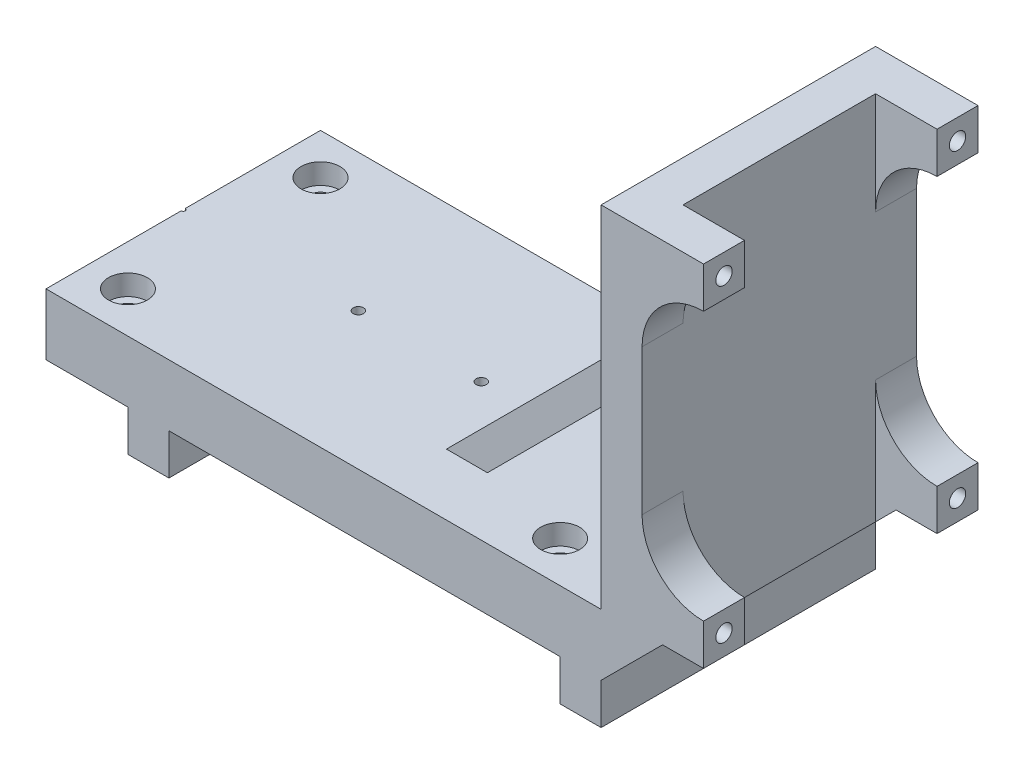
from build123d import *

# Parameters (mm, degrees)
EXTRUDE_2_DEPTH              = 67
CUT_EXTRUDE_5_DEPTH          = 15
CUT_EXTRUDE_6_DEPTH          = 15
SKETCH_4_W                   = 15
SKETCH_4_H                   = 47
CUT_EXTRUDE_7_DEPTH          = 100
CUT_EXTRUDE_8_DEPTH          = 100
CUT_EXTRUDE_11_DEPTH         = 25
CUT_EXTRUDE_12_DEPTH         = 25
CUT_EXTRUDE_13_DEPTH         = 25
CUT_EXTRUDE_14_DEPTH         = 25
HOLE_WIZARD_M5_1_D           = 5.5
HOLE_WIZARD_M5_1_CBORE_D     = 9.5
HOLE_WIZARD_M5_1_CBORE_DEPTH = 5
SKETCH_24_R                  = 1.25
CUT_EXTRUDE_15_DEPTH         = 50
SKETCH_25_W                  = 20
SKETCH_25_H                  = 10
CUT_EXTRUDE_16_DEPTH         = 100


with BuildPart() as part:
    # 스케치1 → 보스-돌출2 (new body)
    with BuildSketch(Plane.XY):
        with BuildLine():
            Line((0, 85.5), (0, 52.75))
            Line((0, 52.75), (-52.75, 0))
            Line((-52.75, 0), (-135.5, 0))
            Line((-135.5, 0), (-135.5, -15))
            Line((-135.5, -15), (-115.5, -15))
            Line((-115.5, -15), (-115.5, -25))
            Line((-115.5, -25), (-85.5, -25))
            Line((-85.5, -25), (-85.5, -15))
            Line((-85.5, -15), (-10, -15))
            Line((-10, -15), (-10, -25))
            Line((-10, -25), (0, -25))
            Line((0, -25), (0, -15))
            Line((0, -15), (15, 0))
            Line((15, 0), (25, 0))
            Line((25, 0), (25, 10))
            ThreePointArc((25, 10), (14.393398282, 14.393398282), (10, 25))
            Line((10, 25), (10, 60.5))
            ThreePointArc((10, 60.5), (14.393398282, 71.106601718), (25, 75.5))
            Line((25, 75.5), (25, 85.5))
            Line((25, 85.5), (0, 85.5))
        make_face()
        Polygon((-42.75, 0), (0, 42.75), (0, 0), align=None, mode=Mode.SUBTRACT)
    extrude(amount=EXTRUDE_2_DEPTH)

    # 스케치2 → 컷-돌출5 (cut)
    with BuildSketch(Plane.XY.offset(67)):
        Polygon((0, 52.75), (0, 42.75), (-42.75, 0), (-52.75, 0), align=None)
    extrude(amount=-CUT_EXTRUDE_5_DEPTH, mode=Mode.SUBTRACT)

    # 스케치3 → 컷-돌출6 (cut)
    with BuildSketch(Plane(origin=(0, 0, 0), x_dir=(-1, 0, 0), z_dir=(0, 0, -1))):
        Polygon((0, 52.75), (0, 42.75), (42.75, 0), (52.75, 0), align=None)
    extrude(amount=-CUT_EXTRUDE_6_DEPTH, mode=Mode.SUBTRACT)

    # 스케치4 → 컷-돌출7 (cut)
    with BuildSketch(Plane(origin=(0, 85.5, 0), x_dir=(1, 0, 0), z_dir=(0, 1, 0))):
        with Locations((17.5, -33.5)):
            Rectangle(SKETCH_4_W, SKETCH_4_H)
    extrude(amount=-CUT_EXTRUDE_7_DEPTH, mode=Mode.SUBTRACT)

    # 스케치5 → 컷-돌출8 (cut)
    with BuildSketch(Plane(origin=(0, 0, 0), x_dir=(1, 0, 0), z_dir=(0, 1, 0))):
        with BuildLine():
            ThreePointArc((-135.5, -34), (-135, -33.5), (-135.5, -33))
            Line((-135.5, -33), (-135.5, -33.5))
            Line((-135.5, -33.5), (-135.5, -34))
        make_face()
    extrude(amount=-CUT_EXTRUDE_8_DEPTH, mode=Mode.SUBTRACT)

    # 스케치8 → 컷-돌출11 (cut)
    with BuildSketch(Plane(origin=(25, 0, 0), x_dir=(0, 0, -1), z_dir=(1, 0, 0))):
        with BuildLine():
            ThreePointArc((-60, 80.5), (-62, 82.5), (-64, 80.5))
            Line((-64, 80.5), (-60, 80.5))
        make_face()
        with BuildLine():
            Line((-60, 80.5), (-64, 80.5))
            ThreePointArc((-64, 80.5), (-62, 78.5), (-60, 80.5))
        make_face()
    extrude(amount=-CUT_EXTRUDE_11_DEPTH, mode=Mode.SUBTRACT)

    # 스케치10 → 컷-돌출12 (cut)
    with BuildSketch(Plane(origin=(25, 0, 0), x_dir=(0, 0, -1), z_dir=(1, 0, 0))):
        with BuildLine():
            ThreePointArc((-3, 80.5), (-5, 82.5), (-7, 80.5))
            Line((-7, 80.5), (-3, 80.5))
        make_face()
        with BuildLine():
            Line((-3, 80.5), (-7, 80.5))
            ThreePointArc((-7, 80.5), (-5, 78.5), (-3, 80.5))
        make_face()
    extrude(amount=-CUT_EXTRUDE_12_DEPTH, mode=Mode.SUBTRACT)

    # 스케치11 → 컷-돌출13 (cut)
    with BuildSketch(Plane(origin=(25, 0, 0), x_dir=(0, 0, -1), z_dir=(1, 0, 0))):
        with BuildLine():
            ThreePointArc((-64, 5), (-62, 3), (-60, 5))
            Line((-60, 5), (-64, 5))
        make_face()
        with BuildLine():
            Line((-64, 5), (-60, 5))
            ThreePointArc((-60, 5), (-62, 7), (-64, 5))
        make_face()
    extrude(amount=-CUT_EXTRUDE_13_DEPTH, mode=Mode.SUBTRACT)

    # 스케치12 → 컷-돌출14 (cut)
    with BuildSketch(Plane(origin=(25, 0, 0), x_dir=(0, 0, -1), z_dir=(1, 0, 0))):
        with BuildLine():
            ThreePointArc((-7, 5), (-5, 3), (-3, 5))
            Line((-3, 5), (-7, 5))
        make_face()
        with BuildLine():
            Line((-7, 5), (-3, 5))
            ThreePointArc((-3, 5), (-5, 7), (-7, 5))
        make_face()
    extrude(amount=-CUT_EXTRUDE_14_DEPTH, mode=Mode.SUBTRACT)

    # M5 소켓 머리 캡 나사용 카운터보어1 (through all)
    with Locations(Plane(origin=(0, 0, 0), x_dir=(1, 0, 0), z_dir=(0, 1, 0))):
        with Locations((-125.5, -10), (-125.5, -57), (-20, -10), (-20, -57)):
            CounterBoreHole(HOLE_WIZARD_M5_1_D / 2, HOLE_WIZARD_M5_1_CBORE_D / 2, HOLE_WIZARD_M5_1_CBORE_DEPTH)

    # 스케치24 → 컷-돌출15 (cut)
    with BuildSketch(Plane(origin=(0, 0, 0), x_dir=(1, 0, 0), z_dir=(0, 1, 0))):
        with Locations(Location((-62.75, -33.5, 0), (0, 0, 180))):
            Circle(SKETCH_24_R)
        with Locations(Location((-92.75, -33.5, 0), (0, 0, 180))):
            Circle(SKETCH_24_R)
    extrude(amount=-CUT_EXTRUDE_15_DEPTH, mode=Mode.SUBTRACT)

    # 스케치25 → 컷-돌출16 (cut)
    with BuildSketch(Plane(origin=(0, 0, 0), x_dir=(-1, 0, 0), z_dir=(0, 0, -1))):
        with Locations((95.5, -20)):
            Rectangle(SKETCH_25_W, SKETCH_25_H)
    extrude(amount=-CUT_EXTRUDE_16_DEPTH, mode=Mode.SUBTRACT)


solid = part.part
